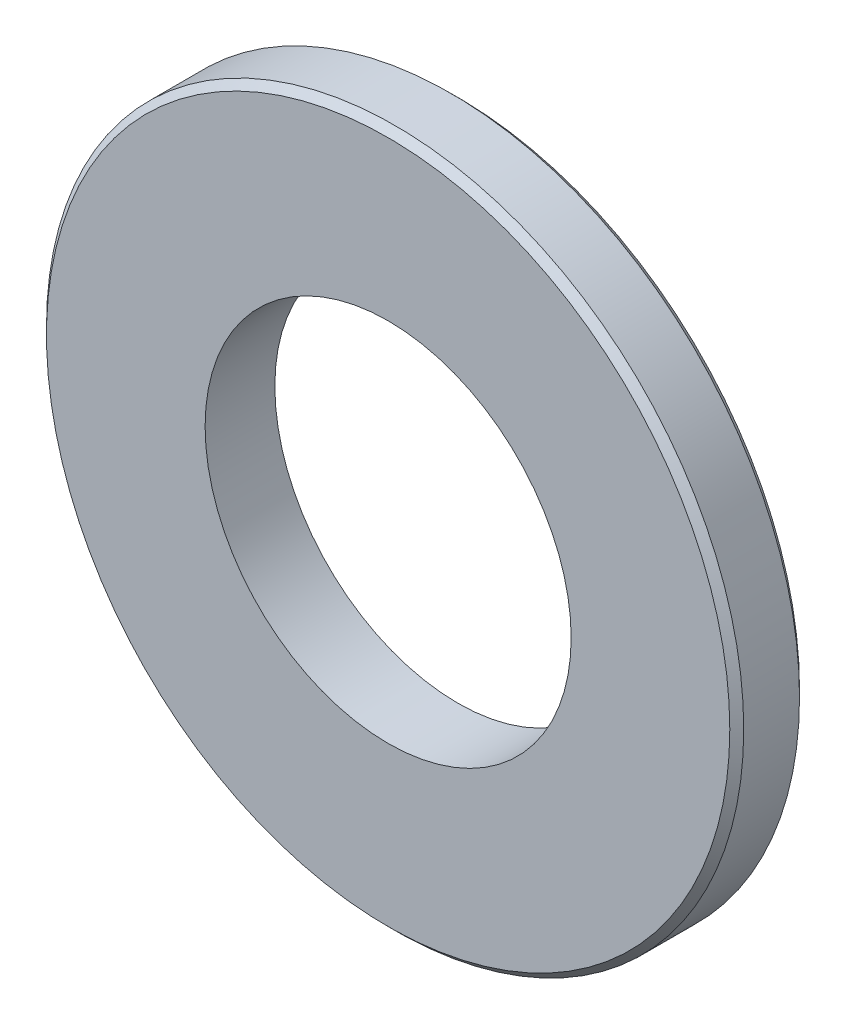
from build123d import *

# Parameters (mm, degrees)
SKETCH1_R           = 10
SKETCH1_R_2         = 5.25
BOSS_EXTRUDE1_DEPTH = 2
CHAMFER1_SIZE       = 0.2


with BuildPart() as part:
    # Sketch1 → Boss-Extrude1 (new body)
    with BuildSketch(Plane.XY):
        Circle(SKETCH1_R)
        Circle(SKETCH1_R_2, mode=Mode.SUBTRACT)
    extrude(amount=BOSS_EXTRUDE1_DEPTH)

    # Chamfer1
    chamfer1_edges = [part.edges().sort_by_distance(p)[0] for p in [
        (-10, 0, 0),
        (-10, 0, 2),
    ]]
    chamfer(chamfer1_edges, length=CHAMFER1_SIZE)


solid = part.part
